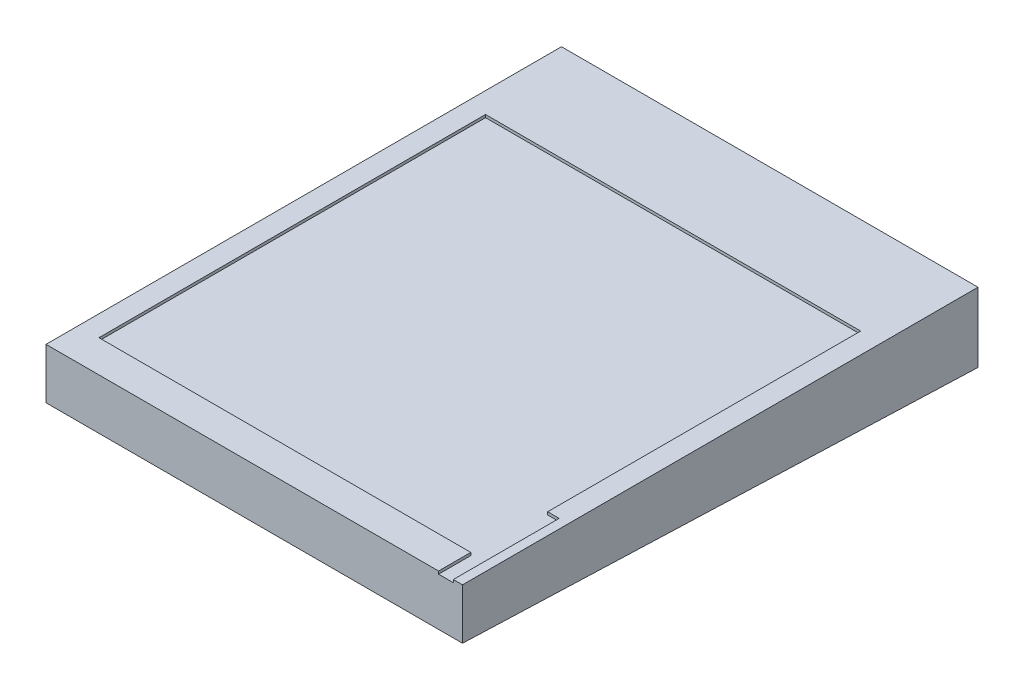
from build123d import *

# Parameters (mm, degrees)
EXTRUDE_1_DEPTH     = 90.5
SKETCH_2_W          = 81.5
SKETCH_2_H          = 84
CUT_EXTRUDE_1_DEPTH = 0.6
SKETCH_3_W          = 3.2
SKETCH_3_H          = 23
CUT_EXTRUDE_2_DEPTH = 0.6


with BuildPart() as part:
    # 草图1 → 凸台-拉伸1 (new body)
    with BuildSketch(Plane(origin=(0, 0, 0), x_dir=(0, 0, -1), z_dir=(1, 0, 0))):
        Polygon((0, 0), (0, -15.1), (-112, -11), (-112, 0), align=None)
    extrude(amount=EXTRUDE_1_DEPTH)

    # 草图2 → 切除-拉伸1 (cut)
    with BuildSketch(Plane(origin=(0, 0, 0), x_dir=(1, 0, 0), z_dir=(0, 1, 0))):
        with Locations((45.25, -63)):
            Rectangle(SKETCH_2_W, SKETCH_2_H)
    extrude(amount=-CUT_EXTRUDE_1_DEPTH, mode=Mode.SUBTRACT)

    # 草图3 → 切除-拉伸2 (cut)
    with BuildSketch(Plane(origin=(0, 0, 0), x_dir=(1, 0, 0), z_dir=(0, 1, 0))):
        with Locations((86.9, -100.5)):
            Rectangle(SKETCH_3_W, SKETCH_3_H)
    extrude(amount=-CUT_EXTRUDE_2_DEPTH, mode=Mode.SUBTRACT)


solid = part.part
